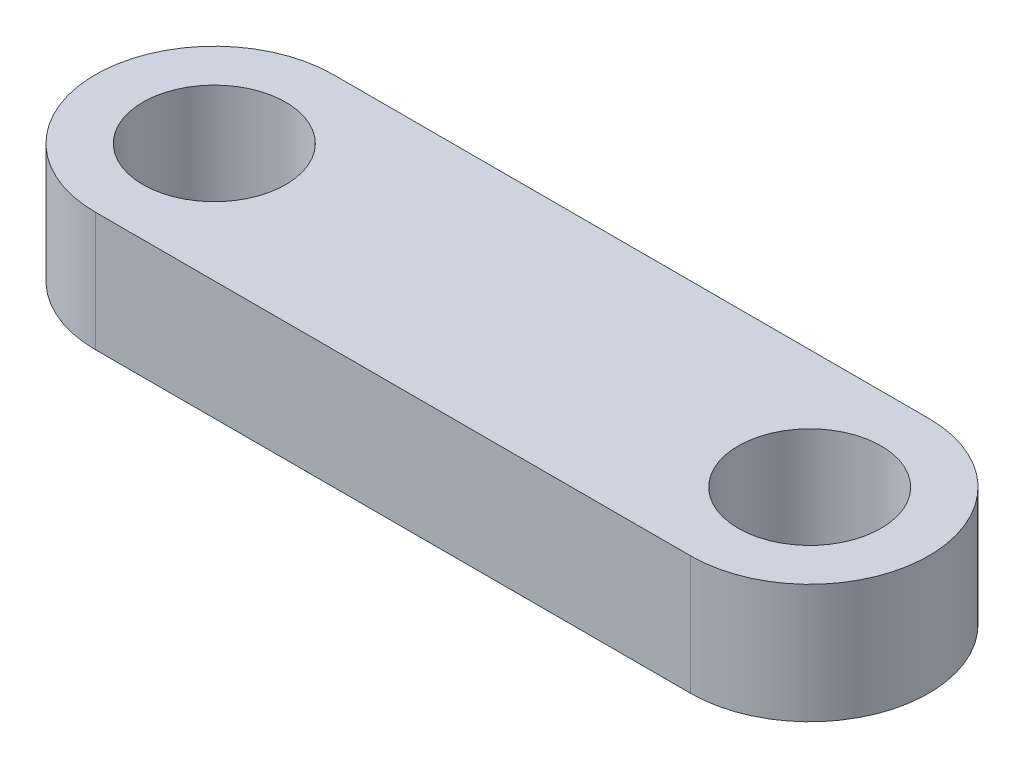
from build123d import *

# Parameters (mm, degrees)
SKETCH1_R           = 1.524
BOSS_EXTRUDE1_DEPTH = 2.54


with BuildPart() as part:
    # Sketch1 → Boss-Extrude1 (new body)
    with BuildSketch(Plane(origin=(0, 0, 0), x_dir=(1, 0, 0), z_dir=(0, 1, 0))):
        with BuildLine():
            Line((-13.35224278, 2.54), (-0.65224278, 2.54))
            ThreePointArc((-0.65224278, 2.54), (1.88775722, 0), (-0.65224278, -2.54))
            Line((-0.65224278, -2.54), (-13.35224278, -2.54))
            ThreePointArc((-13.35224278, -2.54), (-15.89224278, 0), (-13.35224278, 2.54))
        make_face()
        with Locations(Location((-13.35224278, 0, 0), (0, 0, 270))):
            Circle(SKETCH1_R, mode=Mode.SUBTRACT)
        with Locations(Location((-0.65224278, 0, 0), (0, 0, 270))):
            Circle(SKETCH1_R, mode=Mode.SUBTRACT)
    extrude(amount=BOSS_EXTRUDE1_DEPTH)


solid = part.part
